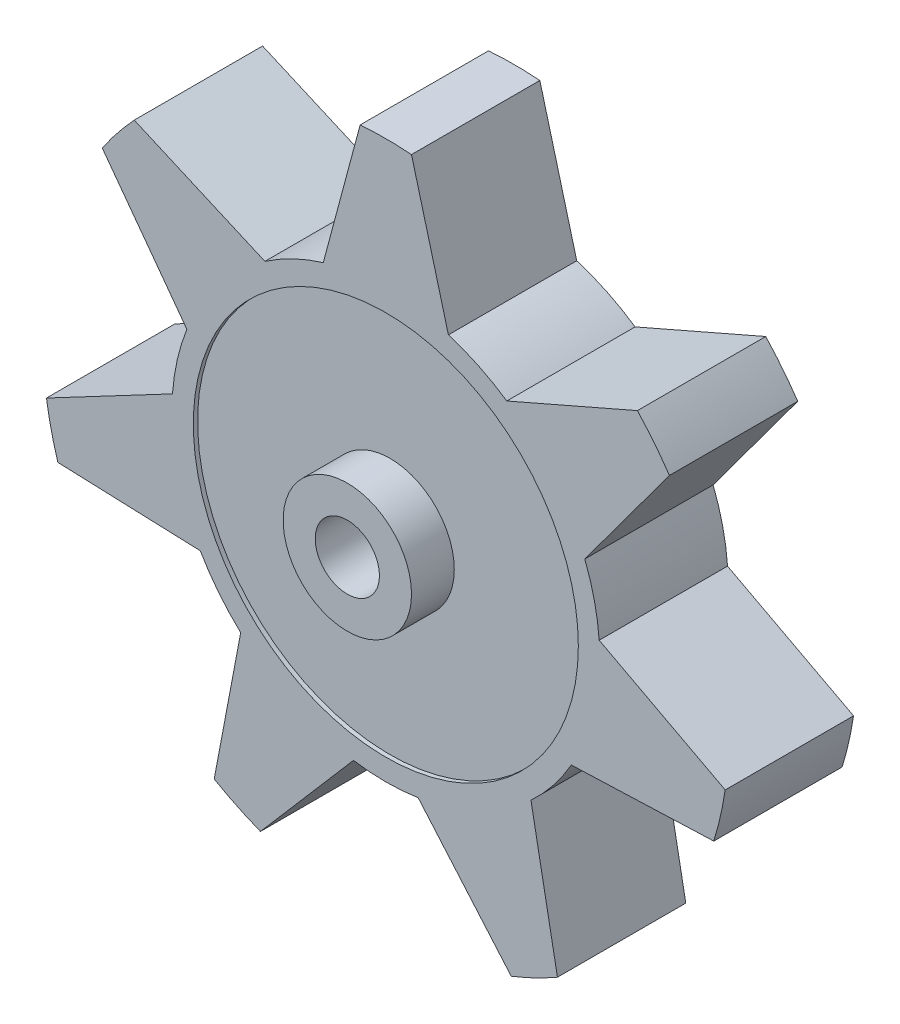
from build123d import *

# Parameters (mm, degrees)
SKETCH1_R           = 5
BOSS_EXTRUDE1_DEPTH = 3
BOSS_EXTRUDE2_DEPTH = 3
CIRPATTERN2_COUNT   = 7
SKETCH3_R           = 4.5
CUT_EXTRUDE1_DEPTH  = 0.1
SKETCH4_R           = 1.5
BOSS_EXTRUDE3_DEPTH = 1
SKETCH5_R           = 0.75
CUT_EXTRUDE2_DEPTH  = 12.937398013


with BuildPart() as part:
    # Sketch1 → Boss-Extrude1 (new body)
    with BuildSketch(Plane.XY):
        Circle(SKETCH1_R)
    extrude(amount=BOSS_EXTRUDE1_DEPTH)

    # Sketch2 → Boss-Extrude2 (add)
    with BuildSketch(Plane.XY.offset(3)):
        with BuildLine():
            Line((-1.46243537, 4.781347382), (1.46243537, 4.781347382))
            Line((1.46243537, 4.781347382), (0.6, 8))
            ThreePointArc((0.6, 8), (0, 8.022468448), (-0.6, 8))
            Line((-0.6, 8), (-1.46243537, 4.781347382))
        make_face()
    boss_extrude2 = extrude(amount=-BOSS_EXTRUDE2_DEPTH)

    # CirPattern2: Boss-Extrude2 ×7 about axis
    cirpattern2_axis = Axis((0, 0, 0), (0, 0, 1))
    for i in range(1, CIRPATTERN2_COUNT):
        add(boss_extrude2.rotate(cirpattern2_axis, i * 360 / CIRPATTERN2_COUNT))

    # Sketch3 → Cut-Extrude1 (cut)
    with BuildSketch(Plane.XY.offset(3)):
        Circle(SKETCH3_R)
    extrude(amount=-CUT_EXTRUDE1_DEPTH, mode=Mode.SUBTRACT)

    # Sketch4 → Boss-Extrude3 (add)
    with BuildSketch(Plane.XY.offset(2.9)):
        Circle(SKETCH4_R)
    extrude(amount=BOSS_EXTRUDE3_DEPTH)

    # Sketch5 → Cut-Extrude2 (cut, through all)
    with BuildSketch(Plane.XY.offset(3.9)):
        Circle(SKETCH5_R)
    extrude(amount=-CUT_EXTRUDE2_DEPTH, mode=Mode.SUBTRACT)


solid = part.part
